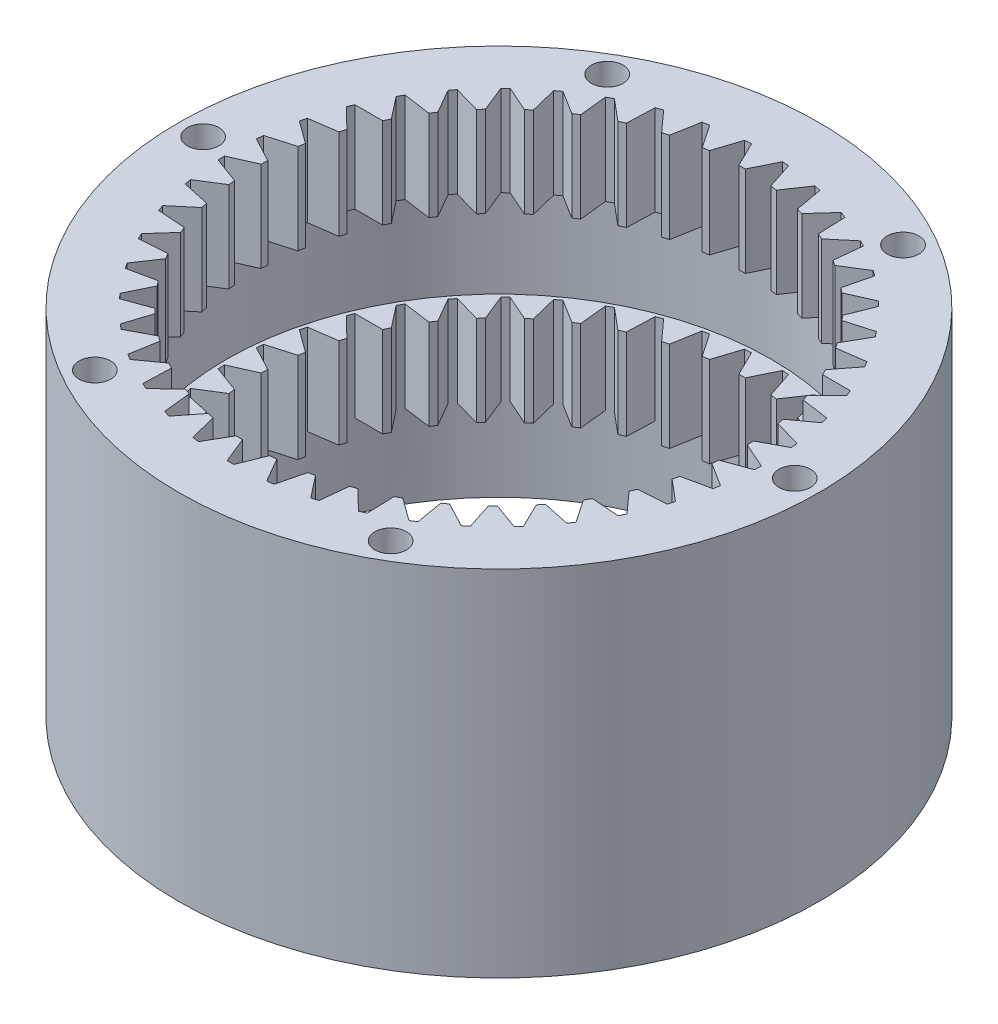
from build123d import *

# Parameters (mm, degrees)
ESBO_O1_R                 = 42.5
ESBO_O1_R_2               = 35.626
RESSALTO_EXTRUS_O1_DEPTH  = 47
RESSALTO_EXTRUS_O2_DEPTH  = 36
PADR_OCIRCULAR2_COUNT     = 45
ESBO_O5_R                 = 36.126
CORTE_EXTRUS_O1_DEPTH     = 12
ESBO_O6_R                 = 2.1
CORTE_EXTRUS_O2_DEPTH     = 10
PADR_OCIRCULAR3_COUNT     = 6
ESPELHAR1_COPY_1_SKETCH_R = 2.1
ESPELHAR1_COPY_1_DEPTH    = 10
ESPELHAR1_COPY_2_SKETCH_R = 2.1
ESPELHAR1_COPY_2_DEPTH    = 10
ESPELHAR1_COPY_3_SKETCH_R = 2.1
ESPELHAR1_COPY_3_DEPTH    = 10
ESPELHAR1_COPY_4_SKETCH_R = 2.1
ESPELHAR1_COPY_4_DEPTH    = 10
ESPELHAR1_COPY_5_SKETCH_R = 2.1
ESPELHAR1_COPY_5_DEPTH    = 10


with BuildPart() as part:
    # Esboço1 → Ressalto-extrusão1 (new body)
    with BuildSketch(Plane(origin=(0, 0, 0), x_dir=(1, 0, 0), z_dir=(0, 1, 0))):
        with Locations(Location((0, 0, 0), (0, 0, 270))):
            Circle(ESBO_O1_R)
        with Locations(Location((0, 0, 0), (0, 0, 270))):
            Circle(ESBO_O1_R_2, mode=Mode.SUBTRACT)
    extrude(amount=-RESSALTO_EXTRUS_O1_DEPTH)

    # Esboço2 → Ressalto-extrusão2 (add)
    with BuildSketch(Plane(origin=(0, 0, 0), x_dir=(1, 0, 0), z_dir=(0, 1, 0))):
        with BuildLine():
            Line((-0.4275, 32.258), (0.4275, 32.258))
            Line((0.4275, 32.258), (2.047440552, 35.567117724))
            ThreePointArc((2.047440552, 35.567117724), (0, 35.626), (-2.047440552, 35.567117724))
            Line((-2.047440552, 35.567117724), (-0.4275, 32.258))
        make_face()
    ressalto_extrus_o2 = extrude(amount=-RESSALTO_EXTRUS_O2_DEPTH)

    # PadrãoCircular2: Ressalto-extrusão2 ×45 about axis
    padr_ocircular2_axis = Axis((0, 0, 0), (0, 1, 0))
    for i in range(1, PADR_OCIRCULAR2_COUNT):
        add(ressalto_extrus_o2.rotate(padr_ocircular2_axis, i * 360 / PADR_OCIRCULAR2_COUNT))

    # Esboço5 → Corte-extrusão1 (cut)
    with BuildSketch(Plane(origin=(0, -12, 0), x_dir=(1, 0, 0), z_dir=(0, 1, 0))):
        with Locations(Location((0, 0, 0), (0, 0, 270))):
            Circle(ESBO_O5_R)
    extrude(amount=-CORTE_EXTRUS_O1_DEPTH, mode=Mode.SUBTRACT)

    # Esboço6 → Corte-extrusão2 (cut)
    with BuildSketch(Plane.XZ.offset(47)):
        with Locations(Location((19.625, 33.991497099, 0), (0, 0, 270))):
            Circle(ESBO_O6_R)
    corte_extrus_o2 = extrude(amount=-CORTE_EXTRUS_O2_DEPTH, mode=Mode.SUBTRACT)

    # PadrãoCircular3: Corte-extrusão2 ×6 about axis
    padr_ocircular3_axis = Axis((0, 0, 0), (0, 1, 0))
    for i in range(1, PADR_OCIRCULAR3_COUNT):
        add(corte_extrus_o2.rotate(padr_ocircular3_axis, i * 360 / PADR_OCIRCULAR3_COUNT), mode=Mode.SUBTRACT)

    # Espelhar1: Corte-extrusão2 across plane
    add(corte_extrus_o2.mirror(Plane(origin=(0, -23.5, 0), x_dir=(0, 0, 1), z_dir=(0, -1, 0))), mode=Mode.SUBTRACT)

    # Espelhar1 copy 1 sketch → Espelhar1 copy 1 (cut)
    with BuildSketch(Plane(origin=(0, 0, 0), x_dir=(0.5000000000000001, 0, -0.8660254037844386), z_dir=(0, 1, 0))):
        with Locations((19.625, -33.991497099)):
            Circle(ESPELHAR1_COPY_1_SKETCH_R)
    extrude(amount=-ESPELHAR1_COPY_1_DEPTH, mode=Mode.SUBTRACT)

    # Espelhar1 copy 2 sketch → Espelhar1 copy 2 (cut)
    with BuildSketch(Plane(origin=(0, 0, 0), x_dir=(-0.4999999999999998, 0, -0.8660254037844387), z_dir=(0, 1, 0))):
        with Locations((19.625, -33.991497099)):
            Circle(ESPELHAR1_COPY_2_SKETCH_R)
    extrude(amount=-ESPELHAR1_COPY_2_DEPTH, mode=Mode.SUBTRACT)

    # Espelhar1 copy 3 sketch → Espelhar1 copy 3 (cut)
    with BuildSketch(Plane(origin=(0, 0, 0), x_dir=(-1, 0, 0), z_dir=(0, 1, 0))):
        with Locations((19.625, -33.991497099)):
            Circle(ESPELHAR1_COPY_3_SKETCH_R)
    extrude(amount=-ESPELHAR1_COPY_3_DEPTH, mode=Mode.SUBTRACT)

    # Espelhar1 copy 4 sketch → Espelhar1 copy 4 (cut)
    with BuildSketch(Plane(origin=(0, 0, 0), x_dir=(-0.5000000000000004, 0, 0.8660254037844384), z_dir=(0, 1, 0))):
        with Locations((19.625, -33.991497099)):
            Circle(ESPELHAR1_COPY_4_SKETCH_R)
    extrude(amount=-ESPELHAR1_COPY_4_DEPTH, mode=Mode.SUBTRACT)

    # Espelhar1 copy 5 sketch → Espelhar1 copy 5 (cut)
    with BuildSketch(Plane(origin=(0, 0, 0), x_dir=(0.5000000000000001, 0, 0.8660254037844386), z_dir=(0, 1, 0))):
        with Locations((19.625, -33.991497099)):
            Circle(ESPELHAR1_COPY_5_SKETCH_R)
    extrude(amount=-ESPELHAR1_COPY_5_DEPTH, mode=Mode.SUBTRACT)


solid = part.part
